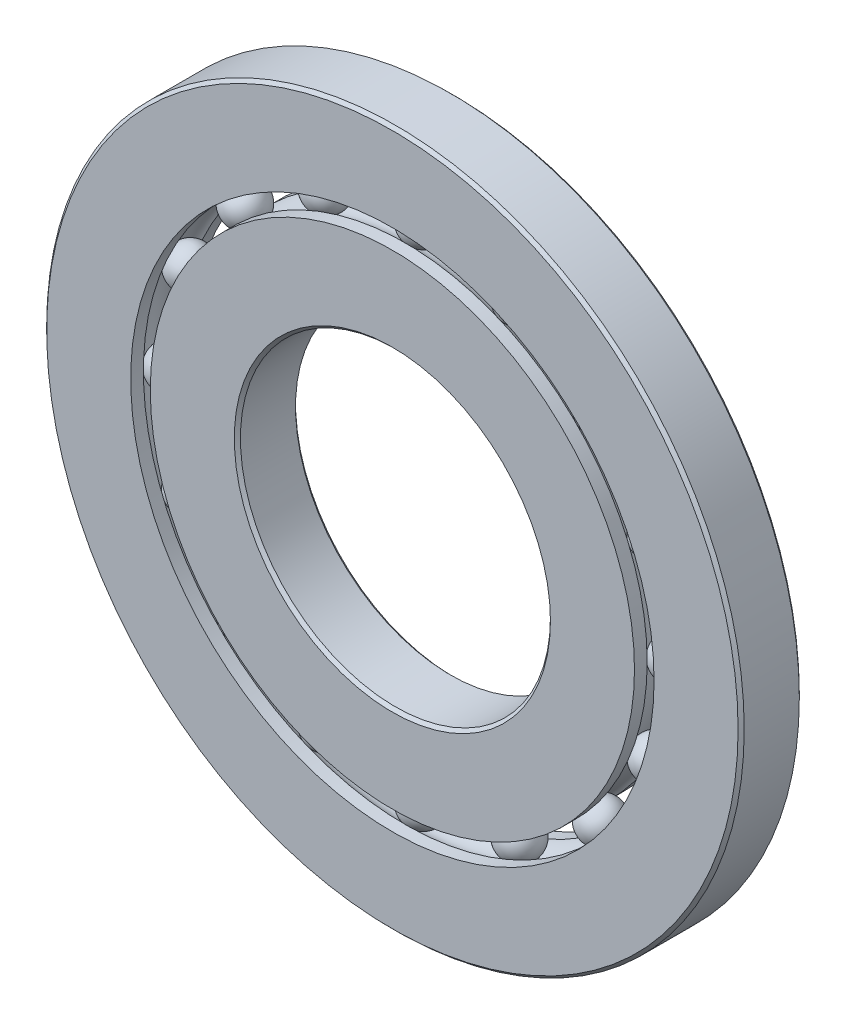
from build123d import *

# Parameters (mm, degrees)
CIRPATTERN1_COUNT = 16


with BuildPart() as part:
    # Sketch1 → Revolve1 (revolve)
    with BuildSketch(Plane(origin=(0, 0, 0), x_dir=(0, 0, -1), z_dir=(1, 0, 0))):
        with BuildLine():
            Line((0.3555, 4.5), (-0.3555, 4.5))
            Line((-0.3555, 4.5), (-0.395, 4.4605))
            Line((-0.395, 4.4605), (-0.395, 3.376307692))
            Line((-0.395, 3.376307692), (-0.231064518, 3.376307692))
            ThreePointArc((-0.231064518, 3.376307692), (0, 3.513333333), (0.231064518, 3.376307692))
            Line((0.231064518, 3.376307692), (0.395, 3.376307692))
            Line((0.395, 3.376307692), (0.395, 4.4605))
            Line((0.395, 4.4605), (0.3555, 4.5))
        make_face()
    revolve(axis=Axis((0, 0, 0.395), (0, 0, -1)))


with BuildPart() as body_2:
    # Sketch3 → Revolve3 (revolve)
    with BuildSketch(Plane(origin=(0, 0, 0), x_dir=(0, 0, -1), z_dir=(1, 0, 0))):
        with BuildLine():
            Line((-0.395, 3.123692308), (-0.231064518, 3.123692308))
            ThreePointArc((-0.231064518, 3.123692308), (0, 2.986666667), (0.231064518, 3.123692308))
            Line((0.231064518, 3.123692308), (0.395, 3.123692308))
            Line((0.395, 3.123692308), (0.395, 2.0395))
            Line((0.395, 2.0395), (0.3555, 2))
            Line((0.3555, 2), (-0.3555, 2))
            Line((-0.3555, 2), (-0.395, 2.0395))
            Line((-0.395, 2.0395), (-0.395, 3.123692308))
        make_face()
    revolve(axis=Axis((0, 0, 0.395), (0, 0, -1)))


with BuildPart() as body_3:
    # Sketch4 → Revolve4 (revolve)
    with BuildSketch(Plane(origin=(0, 0, 0), x_dir=(0, 0, -1), z_dir=(1, 0, 0))):
        with BuildLine():
            Line((-0.263333333, 3.25), (0.263333333, 3.25))
            ThreePointArc((0.263333333, 3.25), (0, 3.513333333), (-0.263333333, 3.25))
        make_face()
    revolve(axis=Axis((0, 3.25, 0.263333333), (0, 0, -1)))


with BuildPart() as cirpattern1_1:
    # CirPattern1: pattern copy
    add(body_3.part.rotate(Axis((0, 0, -0.395), (0, 0, 1)), 1 * 360 / CIRPATTERN1_COUNT))


with BuildPart() as cirpattern1_2:
    # CirPattern1: pattern copy
    add(body_3.part.rotate(Axis((0, 0, -0.395), (0, 0, 1)), 2 * 360 / CIRPATTERN1_COUNT))


with BuildPart() as cirpattern1_3:
    # CirPattern1: pattern copy
    add(body_3.part.rotate(Axis((0, 0, -0.395), (0, 0, 1)), 3 * 360 / CIRPATTERN1_COUNT))


with BuildPart() as cirpattern1_4:
    # CirPattern1: pattern copy
    add(body_3.part.rotate(Axis((0, 0, -0.395), (0, 0, 1)), 4 * 360 / CIRPATTERN1_COUNT))


with BuildPart() as cirpattern1_5:
    # CirPattern1: pattern copy
    add(body_3.part.rotate(Axis((0, 0, -0.395), (0, 0, 1)), 5 * 360 / CIRPATTERN1_COUNT))


with BuildPart() as cirpattern1_6:
    # CirPattern1: pattern copy
    add(body_3.part.rotate(Axis((0, 0, -0.395), (0, 0, 1)), 6 * 360 / CIRPATTERN1_COUNT))


with BuildPart() as cirpattern1_7:
    # CirPattern1: pattern copy
    add(body_3.part.rotate(Axis((0, 0, -0.395), (0, 0, 1)), 7 * 360 / CIRPATTERN1_COUNT))


with BuildPart() as cirpattern1_8:
    # CirPattern1: pattern copy
    add(body_3.part.rotate(Axis((0, 0, -0.395), (0, 0, 1)), 8 * 360 / CIRPATTERN1_COUNT))


with BuildPart() as cirpattern1_9:
    # CirPattern1: pattern copy
    add(body_3.part.rotate(Axis((0, 0, -0.395), (0, 0, 1)), 9 * 360 / CIRPATTERN1_COUNT))


with BuildPart() as cirpattern1_10:
    # CirPattern1: pattern copy
    add(body_3.part.rotate(Axis((0, 0, -0.395), (0, 0, 1)), 10 * 360 / CIRPATTERN1_COUNT))


with BuildPart() as cirpattern1_11:
    # CirPattern1: pattern copy
    add(body_3.part.rotate(Axis((0, 0, -0.395), (0, 0, 1)), 11 * 360 / CIRPATTERN1_COUNT))


with BuildPart() as cirpattern1_12:
    # CirPattern1: pattern copy
    add(body_3.part.rotate(Axis((0, 0, -0.395), (0, 0, 1)), 12 * 360 / CIRPATTERN1_COUNT))


with BuildPart() as cirpattern1_13:
    # CirPattern1: pattern copy
    add(body_3.part.rotate(Axis((0, 0, -0.395), (0, 0, 1)), 13 * 360 / CIRPATTERN1_COUNT))


with BuildPart() as cirpattern1_14:
    # CirPattern1: pattern copy
    add(body_3.part.rotate(Axis((0, 0, -0.395), (0, 0, 1)), 14 * 360 / CIRPATTERN1_COUNT))


with BuildPart() as cirpattern1_15:
    # CirPattern1: pattern copy
    add(body_3.part.rotate(Axis((0, 0, -0.395), (0, 0, 1)), 15 * 360 / CIRPATTERN1_COUNT))


solid = Compound([part.part, body_2.part, body_3.part, cirpattern1_1.part, cirpattern1_2.part, cirpattern1_3.part, cirpattern1_4.part, cirpattern1_5.part, cirpattern1_6.part, cirpattern1_7.part, cirpattern1_8.part, cirpattern1_9.part, cirpattern1_10.part, cirpattern1_11.part, cirpattern1_12.part, cirpattern1_13.part, cirpattern1_14.part, cirpattern1_15.part])
